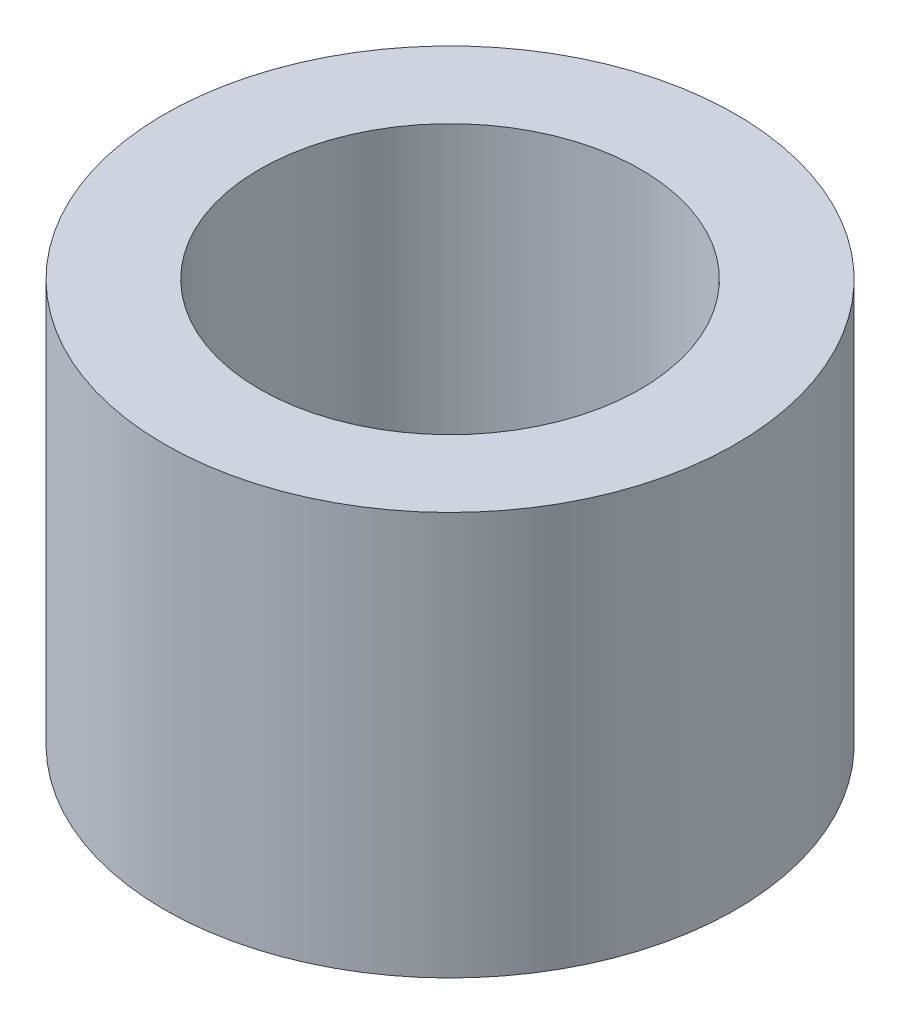
from build123d import *

# Parameters (mm, degrees)
SKETCH1_R           = 9
SKETCH1_R_2         = 6
BOSS_EXTRUDE1_DEPTH = 12.7


with BuildPart() as part:
    # Sketch1 → Boss-Extrude1 (new body)
    with BuildSketch(Plane(origin=(0, 0, 0), x_dir=(1, 0, 0), z_dir=(0, 1, 0))):
        with Locations(Location((0, 0, 0), (0, 0, 270))):
            Circle(SKETCH1_R)
        with Locations(Location((0, 0, 0), (0, 0, 270))):
            Circle(SKETCH1_R_2, mode=Mode.SUBTRACT)
    extrude(amount=BOSS_EXTRUDE1_DEPTH)


solid = part.part
